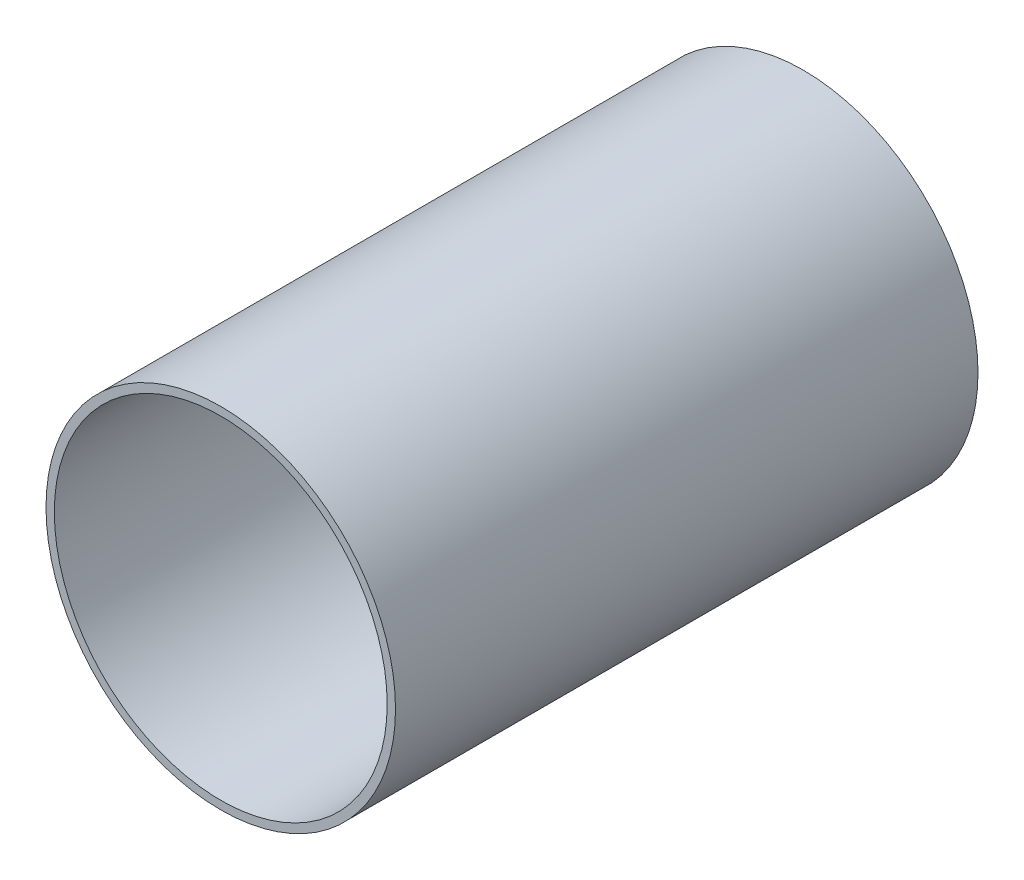
from build123d import *

# Parameters (mm, degrees)
SKETCH1_R           = 21
SKETCH1_R_2         = 20
BOSS_EXTRUDE1_DEPTH = 70


with BuildPart() as part:
    # Sketch1 → Boss-Extrude1 (new body)
    with BuildSketch(Plane.XY):
        Circle(SKETCH1_R)
        Circle(SKETCH1_R_2, mode=Mode.SUBTRACT)
    extrude(amount=BOSS_EXTRUDE1_DEPTH)


solid = part.part
